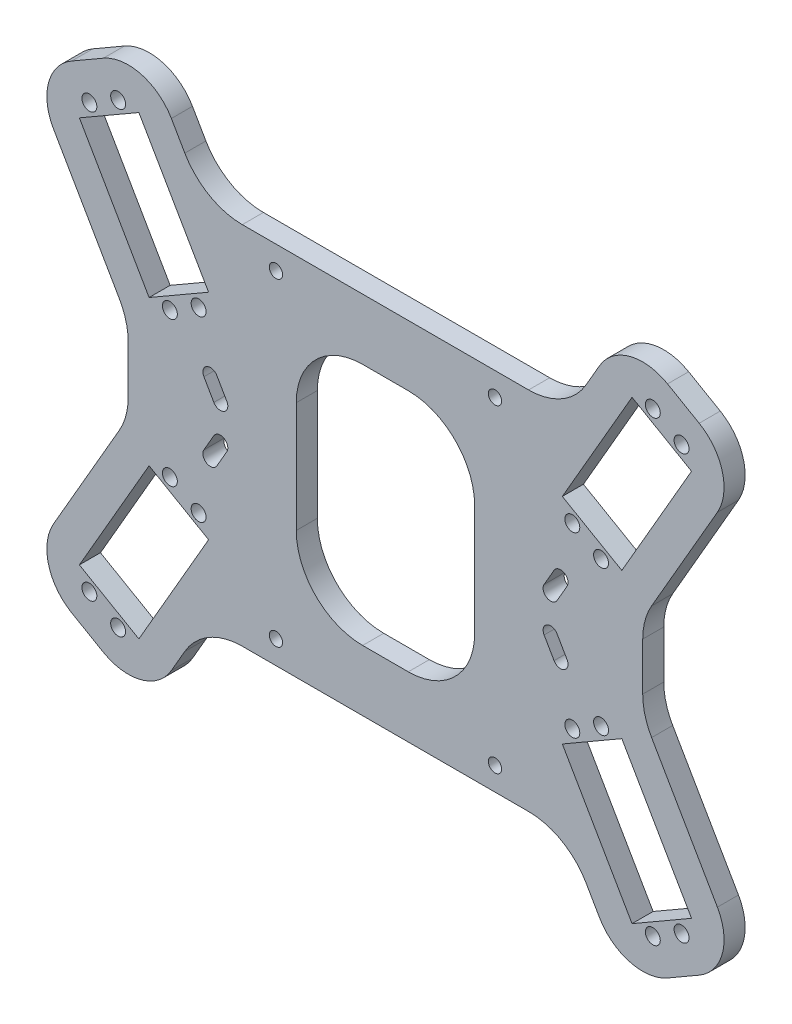
from build123d import *

# Parameters (mm, degrees)
ESQUISSE3_W                   = 53.75
ESQUISSE3_H                   = 73.333333334
BOSS_EXTRU_2_DEPTH            = 6.35
CONG_6_R                      = 20
CONG_7_R                      = 15
ESQUISSE4_R                   = 2.25
ENL_V_MAT_EXTRU_2_DEPTH       = 6.35
SYM_TRIE2_COPY_1_SKETCH_R     = 2.25
SYM_TRIE2_COPY_1_DEPTH        = 6.35
DIAM_TRE_DU_PER_AGE_4_0_4_1_D = 4


with BuildPart() as part:
    # Esquisse3 → Boss.-Extru.2 (new body)
    with BuildSketch(Plane.XY):
        Polygon((-54.672450369, 55), (54.672450369, 55), (71.992958445, 85), (107.5, 64.5), (77.5, 12.538475773), (77.5, -12.538475773), (107.5, -64.5), (71.992958445, -85), (54.672450369, -55), (-54.672450369, -55), (-71.992958445, -85), (-107.5, -64.5), (-77.5, -12.538475773), (-77.5, 12.538475773), (-107.5, 64.5), (-71.992958445, 85), align=None)
        Rectangle(ESQUISSE3_W, ESQUISSE3_H, mode=Mode.SUBTRACT)
    extrude(amount=-BOSS_EXTRU_2_DEPTH)

    # Congé6
    cong_6_edges = [part.edges().sort_by_distance(p)[0] for p in [
        (-54.672450369, 55, -3.175),
        (54.672450369, 55, -3.175),
        (77.5, 12.538475773, -3.175),
        (77.5, -12.538475773, -3.175),
        (54.672450369, -55, -3.175),
        (-54.672450369, -55, -3.175),
        (-77.5, -12.538475773, -3.175),
        (-77.5, 12.538475773, -3.175),
        (-26.875, -36.666666667, -3.175),
        (-26.875, 36.666666667, -3.175),
        (26.875, 36.666666667, -3.175),
        (26.875, -36.666666667, -3.175),
    ]]
    fillet(cong_6_edges, radius=CONG_6_R)

    # Congé7
    cong_7_edges = [part.edges().sort_by_distance(p)[0] for p in [
        (71.992958445, 85, -3.175),
        (107.5, 64.5, -3.175),
        (107.5, -64.5, -3.175),
        (71.992958445, -85, -3.175),
        (-71.992958445, -85, -3.175),
        (-107.5, -64.5, -3.175),
        (-107.5, 64.5, -3.175),
        (-71.992958445, 85, -3.175),
    ]]
    fillet(cong_7_edges, radius=CONG_7_R)

    # Esquisse4 → Enlèv. mat.-Extru.2 (cut)
    with BuildSketch(Plane.XY):
        with Locations((-56.291352203, 26.80402023)):
            Circle(ESQUISSE4_R)
        with Locations((-64.951606241, 21.80402023)):
            Circle(ESQUISSE4_R)
        with Locations((-89.201606241, 63.806252313)):
            Circle(ESQUISSE4_R)
        with Locations((-80.541352203, 68.806252313)):
            Circle(ESQUISSE4_R)
        Polygon((-53.283116293, 32.293602792), (-74.283116293, 68.666669751), (-92.209842152, 58.316669751), (-71.209842152, 21.943602792), align=None)
        with BuildLine():
            Line((-51.695036381, 4.342967697), (-54.695036381, 9.53912012))
            ThreePointArc((-54.695036381, 9.53912012), (-53.871479222, 12.612677278), (-50.797922064, 11.78912012))
            Line((-50.797922064, 11.78912012), (-47.797922064, 6.592967697))
            ThreePointArc((-47.797922064, 6.592967697), (-48.621479222, 3.519410539), (-51.695036381, 4.342967697))
        make_face()
    enl_v_mat_extru_2 = extrude(amount=-ENL_V_MAT_EXTRU_2_DEPTH, mode=Mode.SUBTRACT)

    # Symétrie1: Enlèv. mat.-Extru.2 across plane
    add(enl_v_mat_extru_2.mirror(Plane.ZX), mode=Mode.SUBTRACT)

    # Symétrie2: Enlèv. mat.-Extru.2 across plane
    add(enl_v_mat_extru_2.mirror(Plane(origin=(0, 0, 0), x_dir=(0, 0, 1), z_dir=(1, 0, 0))), mode=Mode.SUBTRACT)

    # Symétrie2 copy 1 sketch → Symétrie2 copy 1 (cut)
    with BuildSketch(Plane(origin=(0, 0, 0), x_dir=(-1, 0, 0), z_dir=(0, 0, 1))):
        with Locations((-56.291352203, 26.80402023)):
            Circle(SYM_TRIE2_COPY_1_SKETCH_R)
        with Locations((-64.951606241, 21.80402023)):
            Circle(SYM_TRIE2_COPY_1_SKETCH_R)
        with Locations((-89.201606241, 63.806252313)):
            Circle(SYM_TRIE2_COPY_1_SKETCH_R)
        with Locations((-80.541352203, 68.806252313)):
            Circle(SYM_TRIE2_COPY_1_SKETCH_R)
        Polygon((-53.283116293, 32.293602792), (-74.283116293, 68.666669751), (-92.209842152, 58.316669751), (-71.209842152, 21.943602792), align=None)
        with BuildLine():
            Line((-51.695036381, 4.342967697), (-54.695036381, 9.53912012))
            ThreePointArc((-54.695036381, 9.53912012), (-53.871479222, 12.612677278), (-50.797922064, 11.78912012))
            Line((-50.797922064, 11.78912012), (-47.797922064, 6.592967697))
            ThreePointArc((-47.797922064, 6.592967697), (-48.621479222, 3.519410539), (-51.695036381, 4.342967697))
        make_face()
    extrude(amount=-SYM_TRIE2_COPY_1_DEPTH, mode=Mode.SUBTRACT)

    # Diamètre du perçage Ø4.0 (4)1 (through all)
    with Locations(Plane.XY):
        with Locations((33, 48), (-33, 48), (-33, -48), (33, -48)):
            Hole(DIAM_TRE_DU_PER_AGE_4_0_4_1_D / 2)


solid = part.part
